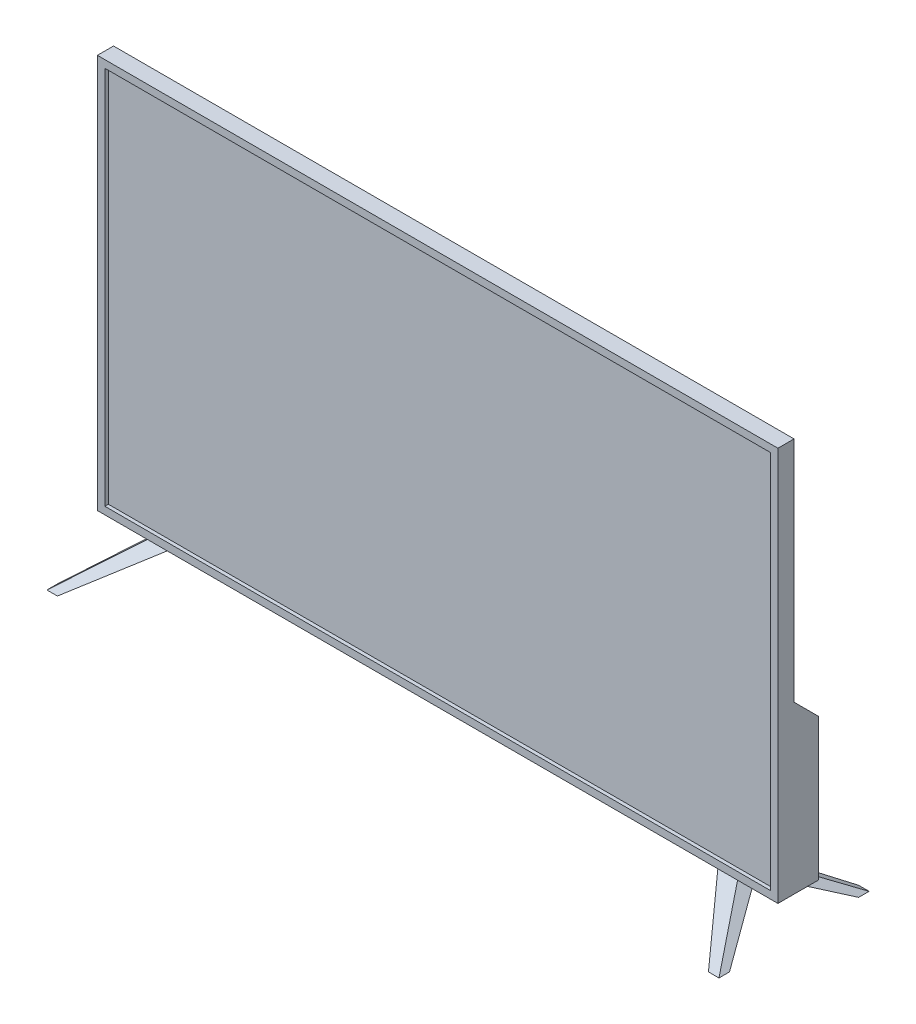
from build123d import *

# Parameters (mm, degrees)
SKETCH2_W           = 1231.9
SKETCH2_H           = 713.74
BOSS_EXTRUDE1_DEPTH = 73.66
BOSS_EXTRUDE2_DEPTH = 608.33
FILLET1_R           = 12.7
CUT_EXTRUDE1_DEPTH  = 1316.517103082
CUT_EXTRUDE2_DEPTH  = 608.33
SKETCH6_W           = 1204.881325014
SKETCH6_H           = 686.721325014
CUT_EXTRUDE3_DEPTH  = 6.35


with BuildPart() as part:
    # Sketch2 → Boss-Extrude1 (new body)
    with BuildSketch(Plane.XY):
        Rectangle(SKETCH2_W, SKETCH2_H)
    extrude(amount=BOSS_EXTRUDE1_DEPTH)

    # Sketch3 → Boss-Extrude2 (add, symmetric)
    with BuildSketch(Plane(origin=(0, 0, 0), x_dir=(0, 0, -1), z_dir=(1, 0, 0))):
        Polygon((-49.53, -356.87), (-172.72, -427.99), (-153.67, -427.99), (-36.83, -369.57), (80.01, -427.99), (99.06, -427.99), (-24.13, -356.87), align=None)
    extrude(amount=BOSS_EXTRUDE2_DEPTH, both=True)

    # Fillet1
    fillet1_edges = [part.edges().sort_by_distance(p)[0] for p in [
        (0, -369.57, 36.83),
    ]]
    fillet(fillet1_edges, radius=FILLET1_R)

    # Sketch4 → Cut-Extrude1 (cut, through all)
    with BuildSketch(Plane(origin=(615.95, 0, 0), x_dir=(0, 0, -1), z_dir=(1, 0, 0))):
        Polygon((0, 356.87), (-44.45, 356.87), (-44.45, -55.88), (0, -100.33), align=None)
    extrude(amount=-CUT_EXTRUDE1_DEPTH, mode=Mode.SUBTRACT)

    # Sketch5 → Cut-Extrude2 (cut, symmetric)
    with BuildSketch(Plane.XY):
        Polygon((-608.33, -427.99), (-523.572484495, -356.87), (-608.33, -356.87), align=None)
        Polygon((-589.28, -427.99), (-485.472484495, -356.87), (485.472484495, -356.87), (589.28, -427.99), align=None)
        Polygon((608.33, -356.87), (608.33, -427.99), (523.572484495, -356.87), align=None)
    extrude(amount=CUT_EXTRUDE2_DEPTH, both=True, mode=Mode.SUBTRACT)

    # Sketch6 → Cut-Extrude3 (cut)
    with BuildSketch(Plane.XY.offset(73.66)):
        Rectangle(SKETCH6_W, SKETCH6_H)
    extrude(amount=-CUT_EXTRUDE3_DEPTH, mode=Mode.SUBTRACT)


solid = part.part
